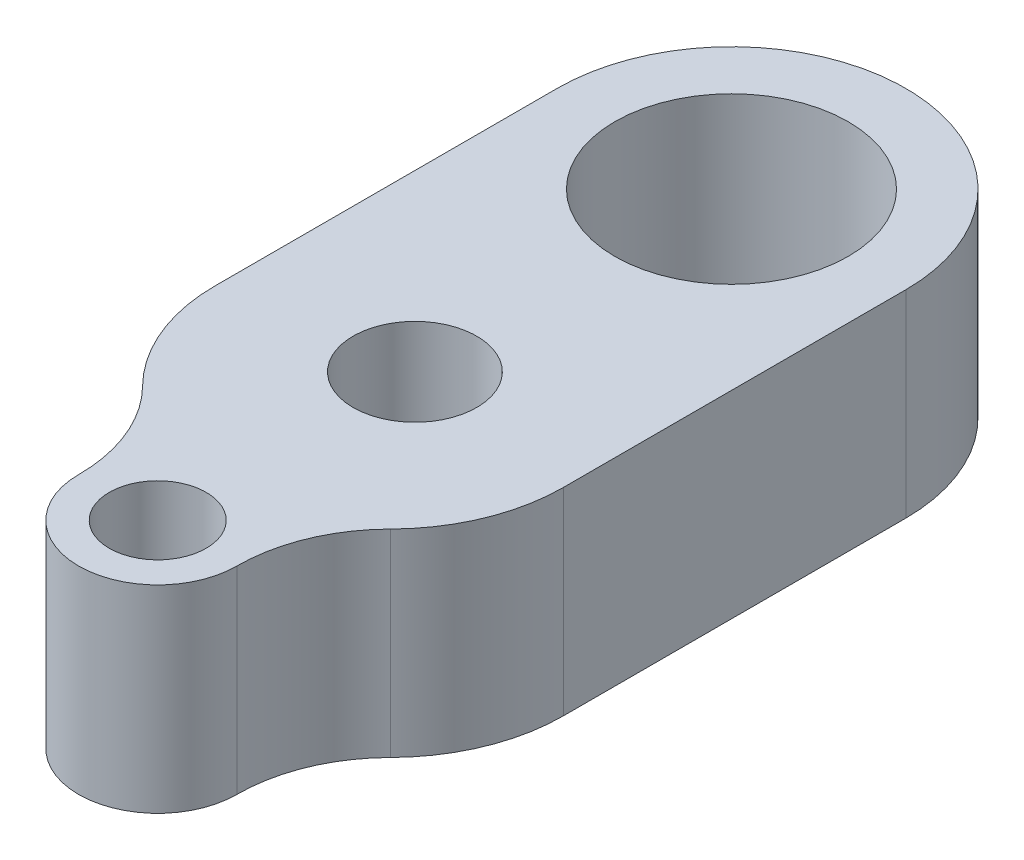
from build123d import *

# Parameters (mm, degrees)
SKETCH1_R           = 0.396875
SKETCH1_R_2         = 0.7493
SKETCH1_R_3         = 0.508
SKETCH1_R_4         = 0.31115
BOSS_EXTRUDE1_DEPTH = 1.27


with BuildPart() as part:
    # Sketch1 → Boss-Extrude1 (new body)
    # profile 1 of 2: a face of its own
    with BuildSketch(Plane(origin=(0, 0, 0), x_dir=(1, 0, 0), z_dir=(0, 1, 0))):
        with BuildLine():
            ThreePointArc((1.099434588, -0.080366688), (-0.019752912, 1.038820812), (-1.138940412, -0.080366688))
            Line((-1.138940412, -0.080366688), (-1.138940412, -2.277654113))
            ThreePointArc((-1.138940412, -2.277654113), (-1.054782424, -2.703441113), (-0.814965083, -3.065193486))
            ThreePointArc((-0.814965083, -3.065193486), (-0.602361057, -3.385895944), (-0.527752912, -3.763366688))
            ThreePointArc((-0.527752912, -3.763366688), (-0.019752912, -3.255366688), (0.488247088, -3.763366688))
            ThreePointArc((0.488247088, -3.763366688), (0.562855233, -3.385895944), (0.775459259, -3.065193486))
            ThreePointArc((0.775459259, -3.065193486), (1.0152766, -2.703441113), (1.099434588, -2.277654113))
            Line((1.099434588, -2.277654113), (1.099434588, -0.080366688))
        make_face()
        with Locations(Location((-0.019752912, -2.112366688, 0), (0, 0, 270))):
            Circle(SKETCH1_R, mode=Mode.SUBTRACT)
        with Locations(Location((-0.019752912, -0.080366688, 0), (0, 0, 270))):
            Circle(SKETCH1_R_2, mode=Mode.SUBTRACT)
    # profile 2 of 2: a face of its own
    with BuildSketch(Plane(origin=(0, 0, 0), x_dir=(1, 0, 0), z_dir=(0, 1, 0))):
        with Locations((-0.019752912, -3.763366688)):
            Circle(SKETCH1_R_3)
        with Locations(Location((-0.019752912, -3.763366688, 0), (0, 0, 270))):
            Circle(SKETCH1_R_4, mode=Mode.SUBTRACT)
    extrude(amount=BOSS_EXTRUDE1_DEPTH)


solid = part.part
